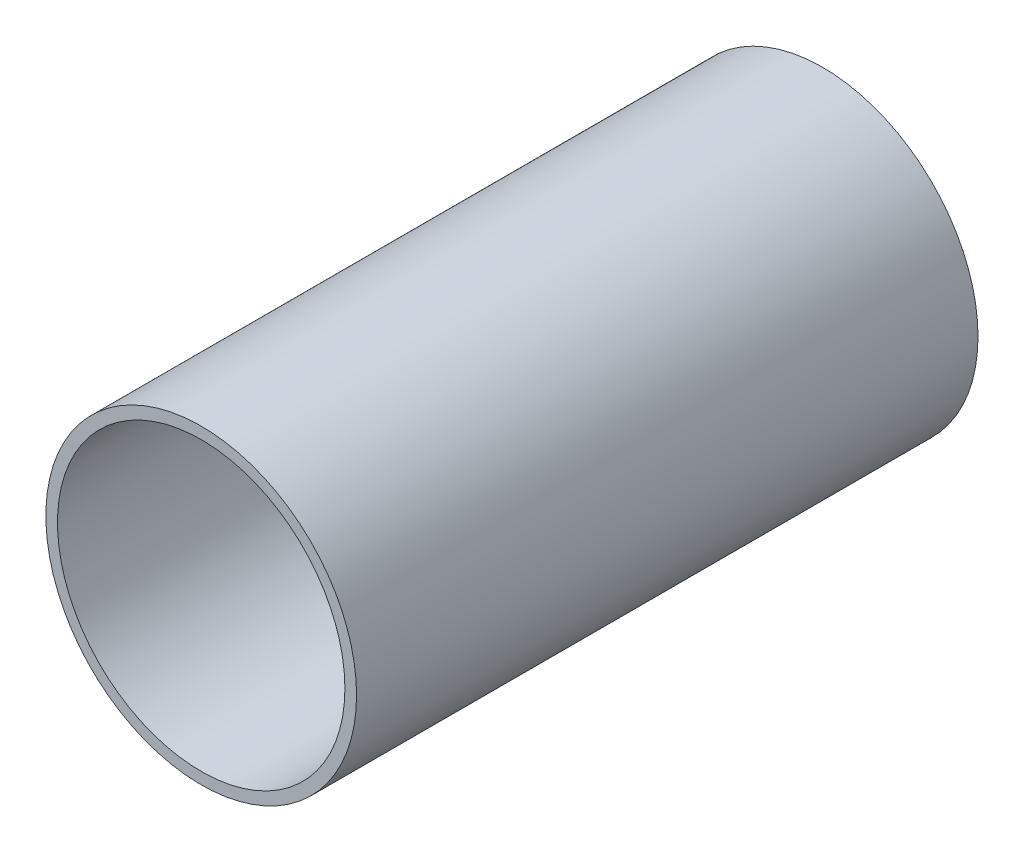
from build123d import *

# Parameters (mm, degrees)
SKETCH_1_R          = 200
EXTRUDE_1_DEPTH     = 800
SKETCH_2_R          = 185
CUT_EXTRUDE_2_DEPTH = 800


with BuildPart() as part:
    # 草图1 → 凸台-拉伸1 (new body)
    with BuildSketch(Plane.XY):
        with Locations((0, 14.683449098)):
            Circle(SKETCH_1_R)
    extrude(amount=EXTRUDE_1_DEPTH)

    # 草图2 → 切除-拉伸2 (cut)
    with BuildSketch(Plane.XY.offset(800)):
        with Locations((0, 14.683449098)):
            Circle(SKETCH_2_R)
    extrude(amount=-CUT_EXTRUDE_2_DEPTH, mode=Mode.SUBTRACT)


solid = part.part
